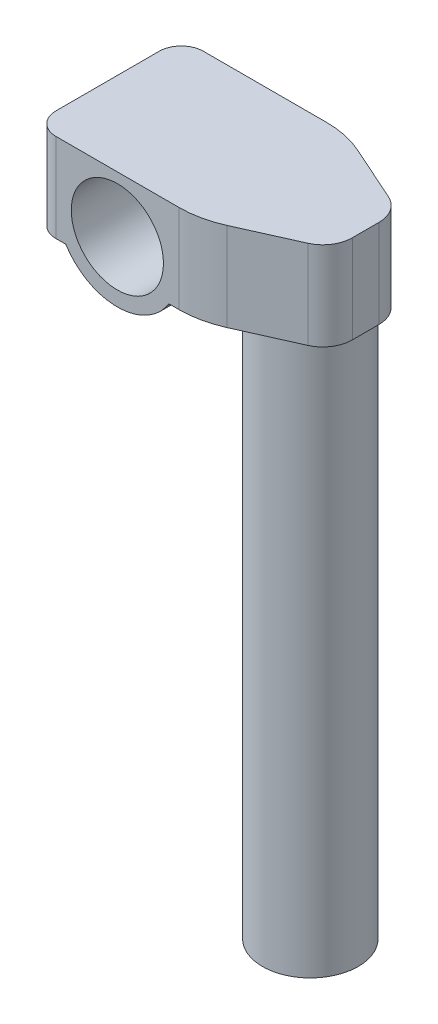
from build123d import *

# Parameters (mm, degrees)
BOSS_EXTRUDE1_DEPTH = 10
SKETCH2_OUTSIDE_W   = 88.614
SKETCH2_OUTSIDE_H   = 38.614
CUT_EXTRUDE1_DEPTH  = 55.083269132
SKETCH3_R           = 13
BOSS_EXTRUDE2_DEPTH = 150
SKETCH15_R          = 12.5
CUT_EXTRUDE2_DEPTH  = 154.495928285


with BuildPart() as part:
    # Sketch1 → Boss-Extrude1 (new, symmetric)
    with BuildSketch(Plane(origin=(0, 0, 0), x_dir=(1, 0, 0), z_dir=(0, 1, 0))):
        with BuildLine():
            Line((4.442128661, 20), (-29, 20))
            ThreePointArc((-29, 20), (-33.242640687, 18.242640687), (-35, 14))
            Line((-35, 14), (-35, -14))
            ThreePointArc((-35, -14), (-33.242640687, -18.242640687), (-29, -20))
            Line((-29, -20), (4.442128661, -20))
            ThreePointArc((4.442128661, -20), (9.877208627, -19.42557582), (15.072131567, -17.727685058))
            Line((15.072131567, -17.727685058), (30.270770125, -10.918694984))
            ThreePointArc((30.270770125, -10.918694984), (33.714393532, -7.967227328), (35, -3.617868812))
            Line((35, -3.617868812), (35, 3.617868812))
            ThreePointArc((35, 3.617868812), (33.714393532, 7.967227328), (30.270770125, 10.918694984))
            Line((30.270770125, 10.918694984), (15.072131567, 17.727685058))
            ThreePointArc((15.072131567, 17.727685058), (9.877208627, 19.42557582), (4.442128661, 20))
        make_face()
    boss_extrude1 = extrude(amount=BOSS_EXTRUDE1_DEPTH, both=True)

    # Sketch2 outside → Cut-Extrude1 (cut, through all)
    with BuildSketch(Plane.XY.offset(20)):
        Rectangle(SKETCH2_OUTSIDE_W, SKETCH2_OUTSIDE_H)
        with BuildLine():
            Line((-35, 10), (-23.9, 10))
            ThreePointArc((-23.9, 10), (-12.33766892, 2.25), (-0.77533784, 10))
            Line((-0.77533784, 10), (35, 10))
            Line((35, 10), (35, 6))
            Line((35, 6), (1.651165913, 6))
            ThreePointArc((1.651165913, 6), (-12.33766892, -1.75), (-26.326503754, 6))
            Line((-26.326503754, 6), (-35, 6))
            Line((-35, 6), (-35, 10))
        make_face(mode=Mode.SUBTRACT)
    extrude(amount=-CUT_EXTRUDE1_DEPTH, mode=Mode.SUBTRACT)

    # Sketch3 → Boss-Extrude2 (add)
    with BuildSketch(Plane.XZ.offset(-6)):
        with Locations(Location((20, 0, 0), (0, 0, 270))):
            Circle(SKETCH3_R)
    extrude(amount=BOSS_EXTRUDE2_DEPTH)

    # Mirror1: Boss-Extrude1 across plane
    add(boss_extrude1.mirror(Plane.ZX.offset(10)))

    # Sketch15 → Cut-Extrude2 (cut, through all)
    with BuildSketch(Plane.XY.offset(20)):
        with Locations((-12.33766892, 14.75)):
            Circle(SKETCH15_R)
    extrude(amount=-CUT_EXTRUDE2_DEPTH, mode=Mode.SUBTRACT)


solid = part.part
